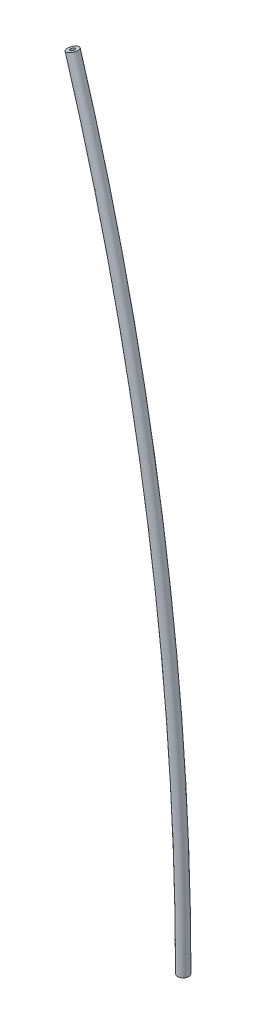
from build123d import *

# Parameters (mm, degrees)
SKETCH2_R   = 1.301639252
SKETCH2_R_2 = 0.539639252


with BuildPart() as part:
    # Sweep-Thin1: sweep along a path in Sketch1
    with BuildLine(Plane.XY) as sweep_thin1_path:
        ThreePointArc((585.654369783, 177.8), (605.41432323, 89.874234763), (612.048920304, 0))
    # Sketch2 → Sweep-Thin1 (sweep)
    with BuildSketch(Plane(origin=(0, 0, 0), x_dir=(1, 0, 0), z_dir=(0, 1, 0))):
        with Locations((610.973470511, 0)):
            Circle(SKETCH2_R)
        with Locations((610.973470511, 0)):
            Circle(SKETCH2_R_2, mode=Mode.SUBTRACT)
    sweep(path=sweep_thin1_path.line)


solid = part.part
